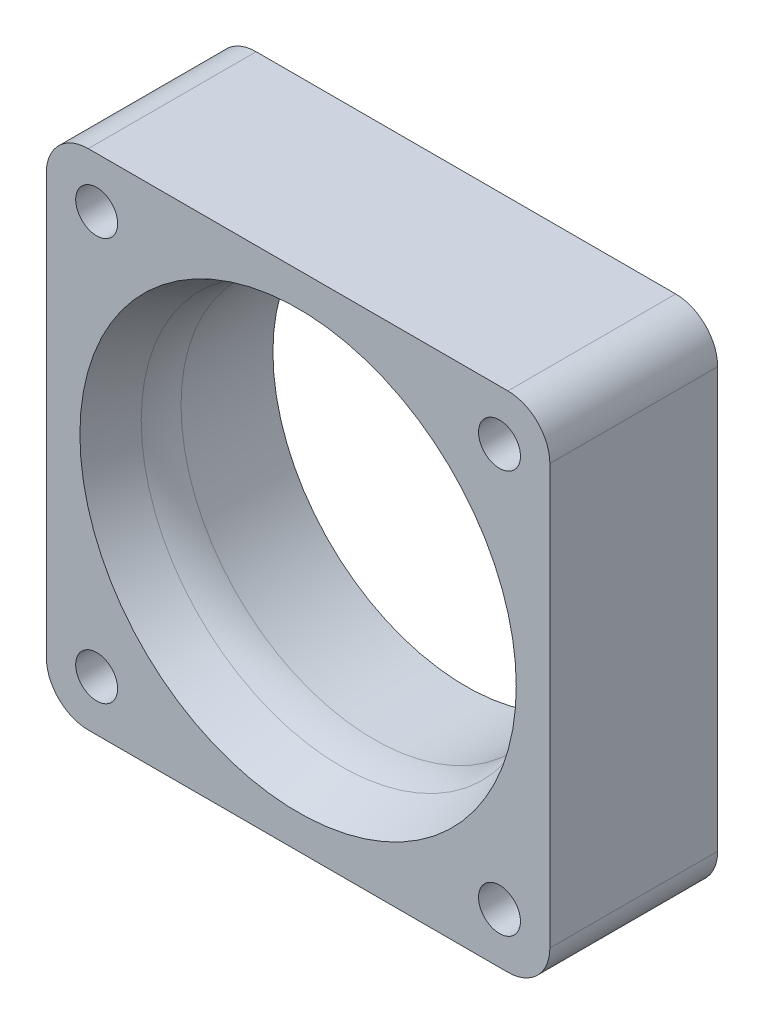
from build123d import *

# Parameters (mm, degrees)
SKETCH1_W           = 30
SKETCH1_H           = 30
BOSS_EXTRUDE1_DEPTH = 10
FILLET1_R           = 2.5
SKETCH2_R           = 1.25
CUT_EXTRUDE1_DEPTH  = 24.452078799
FILLET2_R           = 5


with BuildPart() as part:
    # Sketch1 → Boss-Extrude1 (new body)
    with BuildSketch(Plane.XY):
        Rectangle(SKETCH1_W, SKETCH1_H)
    extrude(amount=BOSS_EXTRUDE1_DEPTH)

    # Fillet1
    fillet1_edges = [part.edges().sort_by_distance(p)[0] for p in [
        (15, -15, 5),
        (-15, -15, 5),
        (-15, 15, 5),
        (15, 15, 5),
    ]]
    fillet(fillet1_edges, radius=FILLET1_R)

    # Sketch2 → Cut-Extrude1 (cut, through all)
    with BuildSketch(Plane.XY.offset(10)):
        with Locations((-12, 12)):
            Circle(SKETCH2_R)
        with Locations((12, 12)):
            Circle(SKETCH2_R)
        with Locations((12, -12)):
            Circle(SKETCH2_R)
        with Locations((-12, -12)):
            Circle(SKETCH2_R)
    extrude(amount=-CUT_EXTRUDE1_DEPTH, mode=Mode.SUBTRACT)

    # Sketch4 → Cut-Revolve1 (revolve, cut)
    with BuildSketch(Plane(origin=(0, 0, 0), x_dir=(0, 0, -1), z_dir=(1, 0, 0)), mode=Mode.PRIVATE) as cut_revolve1_sk:
        Polygon((0, 0), (-10, 0), (-10, 13), (-6.5, 11.5), (0, 11.5), align=None)
    revolve(cut_revolve1_sk.sketch.rotate(Axis((0, 0, 0), (0, 0, 1)), 90), axis=Axis((0, 0, 0), (0, 0, 1)), mode=Mode.SUBTRACT)

    # Fillet2
    fillet2_edges = [part.edges().sort_by_distance(p)[0] for p in [
        (11.5, 0, 6.5),
    ]]
    fillet(fillet2_edges, radius=FILLET2_R)


solid = part.part
